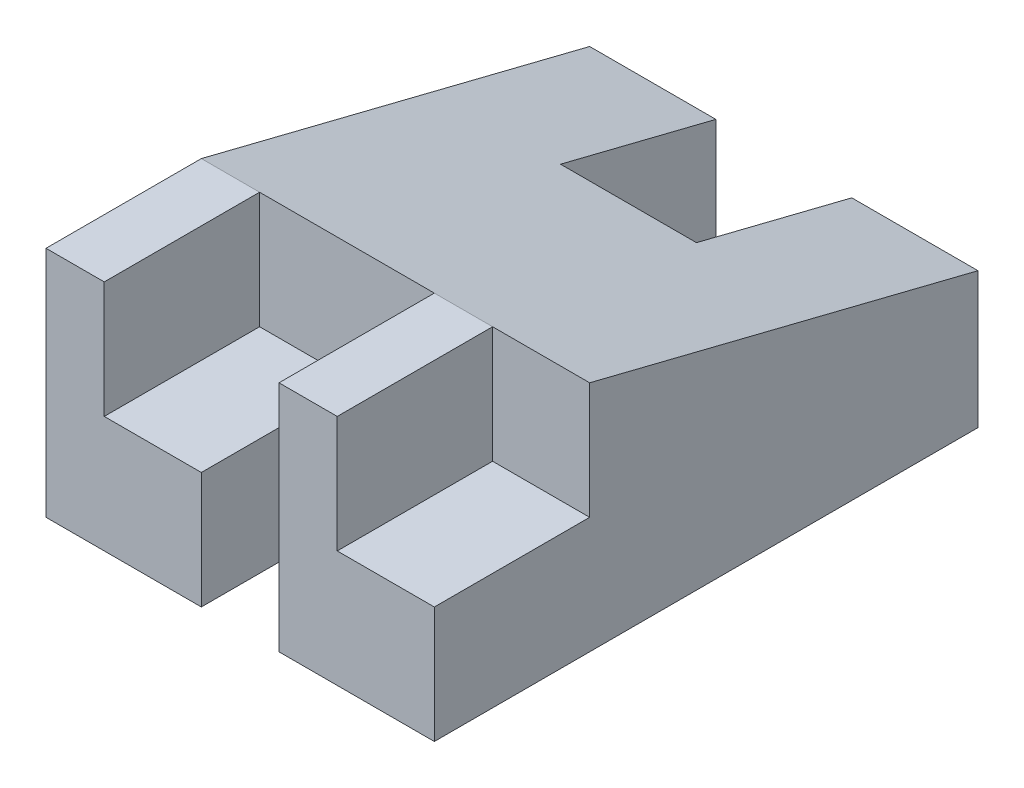
from build123d import *

# Parameters (mm, degrees)
BOSS_EXTRUDE1_DEPTH     = 63.5
CUT_EXTRUDE1_DEPTH      = 81.572467382
CUT_EXTRUDE1_DEPTH_BACK = 63.5
SKETCH5_W               = 22.225
SKETCH5_H               = 25.4
BOSS_EXTRUDE2_DEPTH     = 25.4


with BuildPart() as part:
    # Sketch1 → Boss-Extrude1 (new body)
    with BuildSketch(Plane(origin=(0, 0, 0), x_dir=(0, 0, -1), z_dir=(1, 0, 0))):
        Polygon((-31.75, 0), (31.75, 0), (31.75, 22.225), (-31.75, 38.1), align=None)
    extrude(amount=-BOSS_EXTRUDE1_DEPTH)

    # Sketch5 → Cut-Extrude1 (cut, two sides: drawn at the far end of the back side and taken through both)
    with BuildSketch(Plane.XZ.offset(-CUT_EXTRUDE1_DEPTH_BACK)):
        with Locations((-31.75, -19.05)):
            Rectangle(SKETCH5_W, SKETCH5_H)
    extrude(amount=CUT_EXTRUDE1_DEPTH + CUT_EXTRUDE1_DEPTH_BACK, mode=Mode.SUBTRACT)

    # Sketch9 → Boss-Extrude2 (add)
    with BuildSketch(Plane.XY.offset(31.75)):
        Polygon((0, 0), (-25.4, 0), (-25.4, 38.1), (-15.875, 38.1), (-15.875, 19.05), (0, 19.05), align=None)
        Polygon((-38.1, 0), (-63.5, 0), (-63.5, 38.1), (-53.975, 38.1), (-53.975, 19.05), (-38.1, 19.05), align=None)
    extrude(amount=BOSS_EXTRUDE2_DEPTH)


solid = part.part
